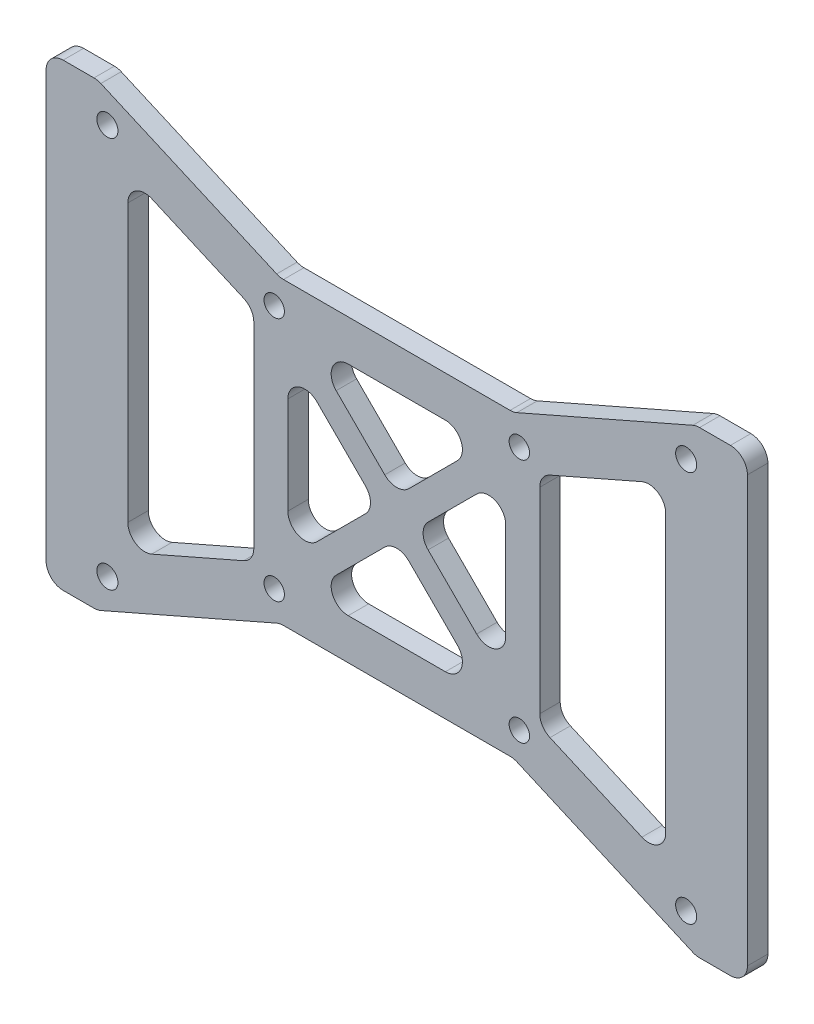
from build123d import *

# Parameters (mm, degrees)
SKETCH_1_W          = 103
SKETCH_1_H          = 67.45
EXTRUDE_1_DEPTH     = 3
SKETCH_2_R          = 1.5
SKETCH_2_R_2        = 1.55
CUT_EXTRUDE_1_DEPTH = 10
CUT_EXTRUDE_2_DEPTH = 10
FILLET_2_R          = 2.5


with BuildPart() as part:
    # 草图1 → 凸台-拉伸1 (new body)
    with BuildSketch(Plane.XY):
        Rectangle(SKETCH_1_W, SKETCH_1_H)
    extrude(amount=EXTRUDE_1_DEPTH)

    # 草图2 → 切除-拉伸1 (cut)
    with BuildSketch(Plane.XY.offset(3)):
        with Locations((-18, 18)):
            Circle(SKETCH_2_R)
        with Locations((18, 18)):
            Circle(SKETCH_2_R)
        with Locations((18, -18)):
            Circle(SKETCH_2_R)
        with Locations((-18, -18)):
            Circle(SKETCH_2_R)
        with Locations((-42.499997562, 28.725)):
            Circle(SKETCH_2_R_2)
        with Locations((-42.499997562, -28.725)):
            Circle(SKETCH_2_R_2)
        with Locations((42.5, -28.725)):
            Circle(SKETCH_2_R_2)
        with Locations((42.5, 28.725)):
            Circle(SKETCH_2_R_2)
    extrude(amount=-CUT_EXTRUDE_1_DEPTH, mode=Mode.SUBTRACT)

    # 草图3 → 切除-拉伸2 (cut)
    with BuildSketch(Plane.XY.offset(3)):
        Polygon((-39.499997562, 24.136880962), (-39.499997562, -24.136880962), (-21, -16.038411836), (-21, 16.038411836), align=None)
        Polygon((-17.162839154, 22), (-23.38778026, 24.725), (-43.947218774, 33.725), (43.947221211, 33.725), (23.387782698, 24.725), (17.162841592, 22), align=None)
        Polygon((39.5, 24.136880962), (21, 16.038410769), (21, -16.038411758), (39.5, -24.136881145), align=None)
        Polygon((-23.38778026, -24.725), (-17.162839154, -22), (17.162839231, -22), (23.387780956, -24.725), (43.947221515, -33.725), (-43.947218774, -33.725), align=None)
        Polygon((-2.828427125, 0), (-16, 13.171572875), (-16, -13.171572875), align=None)
        Polygon((13.171572875, 16), (-13.171572875, 16), (0, 2.828427125), align=None)
        Polygon((2.828427125, 0), (16, 13.171572875), (16, -13.171572875), align=None)
        Polygon((-13.171572875, -16), (0, -2.828427125), (13.171572875, -16), align=None)
    extrude(amount=-CUT_EXTRUDE_2_DEPTH, mode=Mode.SUBTRACT)

    # 圆角2
    fillet_2_edges = [part.edges().sort_by_distance(p)[0] for p in [
        (17.162841592, 22, 1.5),
        (-17.162839154, 22, 1.5),
        (-43.947218774, 33.725, 1.5),
        (43.947221211, 33.725, 1.5),
        (39.5, 24.136880962, 1.5),
        (39.5, -24.136881145, 1.5),
        (21, -16.038411758, 1.5),
        (21, 16.038410769, 1.5),
        (13.171572875, -16, 1.5),
        (-13.171572875, -16, 1.5),
        (0, -2.828427125, 1.5),
        (13.171572875, 16, 1.5),
        (0, 2.828427125, 1.5),
        (-13.171572875, 16, 1.5),
        (16, -13.171572875, 1.5),
        (2.828427125, 0, 1.5),
        (16, 13.171572875, 1.5),
        (-39.499997562, 24.136880962, 1.5),
        (-21, 16.038411836, 1.5),
        (-21, -16.038411836, 1.5),
        (-39.499997562, -24.136880962, 1.5),
        (-51.5, 33.725, 1.5),
        (51.5, 33.725, 1.5),
        (51.5, -33.725, 1.5),
        (-51.5, -33.725, 1.5),
        (-2.828427125, 0, 1.5),
        (-16, -13.171572875, 1.5),
        (-16, 13.171572875, 1.5),
        (-43.947218774, -33.725, 1.5),
        (-17.162839154, -22, 1.5),
        (17.162839231, -22, 1.5),
        (43.947221515, -33.725, 1.5),
    ]]
    fillet(fillet_2_edges, radius=FILLET_2_R)


solid = part.part
